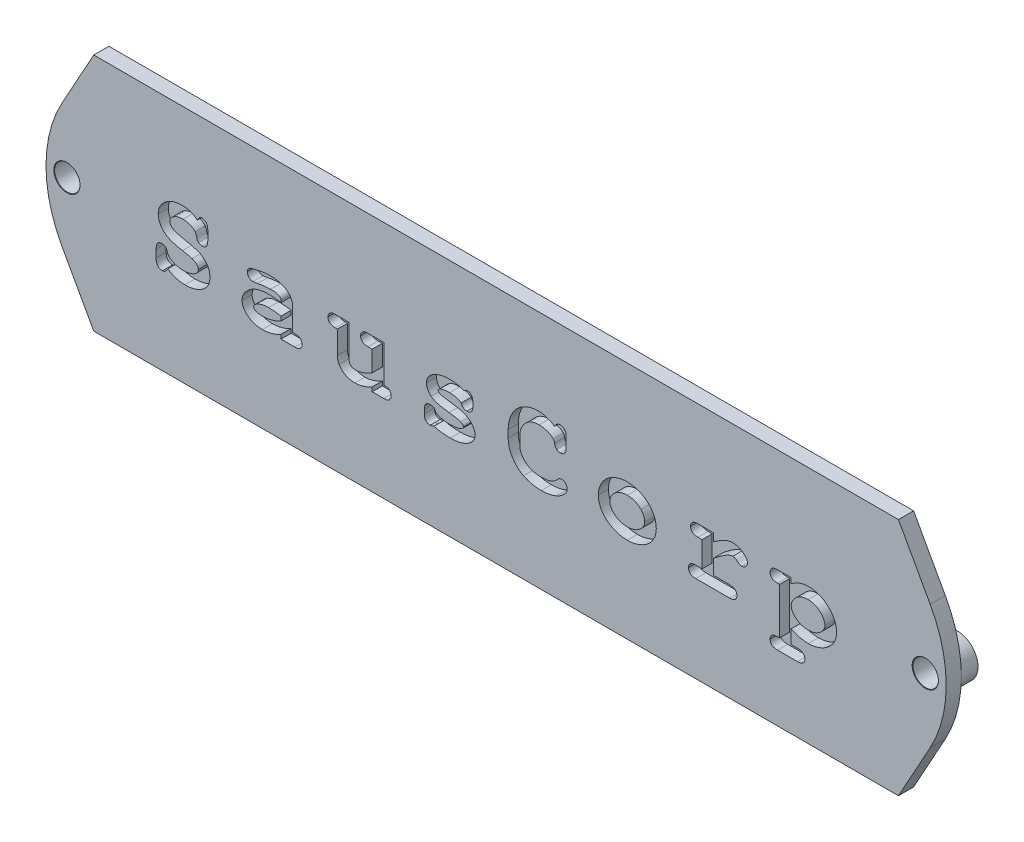
from build123d import *

# Parameters (mm, degrees)
BOSS_EXTRUDE1_DEPTH             = 1.905
SKETCH6_R                       = 2.629225159
BOSS_EXTRUDE4_DEPTH             = 2.095
F_3_0MM_DOWEL_HOLE1_D           = 3.2
F_3_0MM_DOWEL_HOLE1_CSINK_D     = 3.3
F_3_0MM_DOWEL_HOLE1_CSINK_ANGLE = 90
CUT_EXTRUDE1_DEPTH              = 1.27


with BuildPart() as part:
    # Sketch1 → Boss-Extrude1 (new body)
    with BuildSketch(Plane.XY):
        with BuildLine():
            Line((-50.6, 15.04), (50.6, 15.04))
            Line((50.6, 15.04), (54.590317598, 7.813493896))
            ThreePointArc((54.590317598, 7.813493896), (56.604225159, 0), (54.590317598, -7.813493896))
            Line((54.590317598, -7.813493896), (50.6, -15.04))
            Line((50.6, -15.04), (-50.6, -15.04))
            Line((-50.6, -15.04), (-54.590317598, -7.813493896))
            ThreePointArc((-54.590317598, -7.813493896), (-56.604225159, 0), (-54.590317598, 7.813493896))
            Line((-54.590317598, 7.813493896), (-50.6, 15.04))
        make_face()
    extrude(amount=BOSS_EXTRUDE1_DEPTH)

    # Sketch6 → Boss-Extrude4 (add)
    with BuildSketch(Plane(origin=(0, 0, 0), x_dir=(-1, 0, 0), z_dir=(0, 0, -1))):
        with Locations(Location((-53.975, 0, 0), (0, 0, 179.99945392))):
            Circle(SKETCH6_R)
        with Locations(Location((53.975, 0, 0), (0, 0, 359.99945398))):
            Circle(SKETCH6_R)
    extrude(amount=BOSS_EXTRUDE4_DEPTH)

    # Ø3.0mm Dowel Hole1 (through all)
    with Locations(Plane.XY.offset(1.905)):
        with Locations((53.975, 0), (-53.975, 0)):
            CounterSinkHole(F_3_0MM_DOWEL_HOLE1_D / 2, F_3_0MM_DOWEL_HOLE1_CSINK_D / 2, counter_sink_angle=F_3_0MM_DOWEL_HOLE1_CSINK_ANGLE)

    # Sketch4 → Cut-Extrude1 (cut)
    # profile 1 of 8: a face of its own
    with BuildSketch(Plane.XY.offset(1.905)):
        with BuildLine():
            add(Edge.make_bspline(
                [(-41.296390709, -3.597266465), (-41.328827746, -3.649516474), (-41.387859513, -3.744605624), (-41.478438377, -3.868682689), (-41.556521678, -3.963693737), (-41.648037971, -4.050326733), (-41.779409619, -4.114275606), (-41.890752025, -4.122966805), (-41.948826504, -4.1275)],
                knots=[0, 0, 0, 0, 1.249044756, 2.273121245, 3.119062961, 3.744647754, 4.823643111, 6, 6, 6, 6], degree=3))
            add(Edge.make_bspline(
                [(-41.948826504, -4.1275), (-42.007058112, -4.124766299), (-42.118913233, -4.119515224), (-42.278226788, -4.07796583), (-42.417595487, -4.005028344), (-42.541931203, -3.907419107), (-42.63989862, -3.770877994), (-42.706483253, -3.598719603), (-42.747486083, -3.392036812), (-42.75206958, -3.242614611), (-42.75453293, -3.162309268)],
                knots=[0, 0, 0, 0, 0.973747907, 1.870439342, 2.728107132, 3.590507668, 4.491652896, 5.50205726, 6.657507741, 8, 8, 8, 8], degree=3))
            Line((-42.75453293, -3.162309268), (-42.75453293, -2.182619964))
            add(Edge.make_bspline(
                [(-42.75453293, -2.182619964), (-42.752571494, -2.101649711), (-42.748908911, -1.950454205), (-42.712019179, -1.74260147), (-42.654723237, -1.568664494), (-42.565169322, -1.43350303), (-42.453638574, -1.333876212), (-42.327435466, -1.261826088), (-42.184157638, -1.219138506), (-42.083748268, -1.213921251), (-42.031675494, -1.211215558)],
                knots=[0, 0, 0, 0, 1.409758045, 2.632436904, 3.667729113, 4.578857077, 5.422311825, 6.252180417, 7.093572505, 8, 8, 8, 8], degree=3))
            add(Edge.make_bspline(
                [(-42.031675494, -1.211215558), (-41.991538863, -1.212907568), (-41.91403281, -1.216174932), (-41.801519291, -1.238589229), (-41.700197263, -1.280367327), (-41.608042245, -1.337954462), (-41.525495162, -1.41320088), (-41.457641435, -1.512059059), (-41.396317141, -1.629141078), (-41.352163974, -1.763059759), (-41.311706897, -1.894785056), (-41.262875683, -2.006855769), (-41.217902918, -2.097670697), (-41.180401531, -2.145096197), (-41.163832325, -2.166050166)],
                knots=[0, 0, 0, 0, 1.032771384, 1.994338619, 2.934499984, 3.836460035, 4.779302793, 5.784982907, 6.905255321, 8.169512914, 9.405370782, 10.448025371, 11.314292373, 12, 12, 12, 12], degree=3))
            add(Edge.make_bspline(
                [(-41.163832325, -2.166050166), (-41.125292422, -2.201574908), (-41.040651681, -2.279593798), (-40.882324382, -2.383853384), (-40.686372594, -2.48764798), (-40.459947604, -2.594354918), (-40.206558428, -2.68776067), (-39.935213227, -2.751684548), (-39.652624831, -2.796480929), (-39.460088437, -2.800080074), (-39.361866796, -2.801916163)],
                knots=[0, 0, 0, 0, 0.643712458, 1.413711371, 2.321640229, 3.369980337, 4.489889668, 5.634749748, 6.79337743, 8, 8, 8, 8], degree=3))
            add(Edge.make_bspline(
                [(-39.361866796, -2.801916163), (-39.285891699, -2.800709974), (-39.137156055, -2.798348631), (-38.919690017, -2.780312184), (-38.712967635, -2.746375936), (-38.516267439, -2.701370527), (-38.329242459, -2.64335085), (-38.153128783, -2.57319054), (-37.98686466, -2.49015725), (-37.884482556, -2.423209059), (-37.833302934, -2.389742438)],
                knots=[0, 0, 0, 0, 1.134315566, 2.220637595, 3.254383917, 4.25957164, 5.231163857, 6.174850205, 7.087628867, 8, 8, 8, 8], degree=3))
            add(Edge.make_bspline(
                [(-37.833302934, -2.389742438), (-37.774857996, -2.3482627), (-37.66442298, -2.269884387), (-37.544437952, -2.11546032), (-37.463732376, -1.949025481), (-37.456045747, -1.830022728), (-37.452197581, -1.770446239)],
                knots=[0, 0, 0, 0, 1.127408559, 2.13030224, 3.063970995, 4, 4, 4, 4], degree=3))
            add(Edge.make_bspline(
                [(-37.452197581, -1.770446239), (-37.453721892, -1.729393869), (-37.456752804, -1.647766122), (-37.496124711, -1.529398632), (-37.551512376, -1.413428301), (-37.634453511, -1.303356614), (-37.741000118, -1.197752477), (-37.878665602, -1.106035448), (-38.042098431, -1.019581673), (-38.164051838, -0.974314432), (-38.22890686, -0.95024124)],
                knots=[0, 0, 0, 0, 0.811818184, 1.614203749, 2.454243724, 3.356431144, 4.335651608, 5.419560622, 6.627718108, 8, 8, 8, 8], degree=3))
            add(Edge.make_bspline(
                [(-38.22890686, -0.95024124), (-38.255132641, -0.941934857), (-38.313633012, -0.923406277), (-38.411643215, -0.89297677), (-38.532094584, -0.866378787), (-38.672202213, -0.831385737), (-38.834535219, -0.800383403), (-39.016161047, -0.761268695), (-39.219753448, -0.725741385), (-39.361898618, -0.699095796), (-39.436430887, -0.685124472)],
                knots=[0, 0, 0, 0, 0.533700084, 1.190494666, 1.989587104, 2.925169266, 3.991560706, 5.194531176, 6.52898302, 8, 8, 8, 8], degree=3))
            add(Edge.make_bspline(
                [(-39.436430887, -0.685124472), (-39.528329006, -0.668245499), (-39.706927733, -0.635442182), (-39.965847501, -0.581370597), (-40.20856094, -0.52606466), (-40.434677524, -0.466600372), (-40.643737869, -0.400799732), (-40.838381281, -0.338820108), (-41.015320108, -0.270063532), (-41.226034687, -0.174322488), (-41.466896812, -0.041113887), (-41.724324593, 0.151557749), (-41.950834556, 0.373131407), (-42.142525979, 0.622756853), (-42.296472449, 0.893903627), (-42.406385426, 1.179445054), (-42.476375531, 1.475963514), (-42.485041335, 1.67775896), (-42.489416163, 1.779632975)],
                knots=[0, 0, 0, 0, 1.039724996, 2.020645932, 2.94317358, 3.809745427, 4.621449807, 5.381904657, 6.082442966, 6.732275347, 7.956853422, 9.136952481, 10.29959077, 11.472087457, 12.628030181, 13.756610505, 14.867451672, 16, 16, 16, 16], degree=3))
            add(Edge.make_bspline(
                [(-42.489416163, 1.779632975), (-42.487475173, 1.859923808), (-42.483633021, 2.018857997), (-42.439228635, 2.252743368), (-42.373292471, 2.479135469), (-42.282256605, 2.699216659), (-42.159497811, 2.908561043), (-42.014568793, 3.112859321), (-41.841065884, 3.307961191), (-41.643186406, 3.492623827), (-41.42551608, 3.664485841), (-41.188311964, 3.813381639), (-40.935647805, 3.941446133), (-40.666547117, 4.043635615), (-40.381954844, 4.125517663), (-40.081848422, 4.183069089), (-39.765103213, 4.215842853), (-39.549042816, 4.221026249), (-39.438502112, 4.223678175)],
                knots=[0, 0, 0, 0, 0.885991119, 1.753802725, 2.620305997, 3.488687286, 4.377072049, 5.29569036, 6.252193784, 7.255919361, 8.282824222, 9.311285966, 10.344882855, 11.407292653, 12.486464723, 13.612907354, 14.778716939, 16, 16, 16, 16], degree=3))
            add(Edge.make_bspline(
                [(-39.438502112, 4.223678175), (-39.349328865, 4.221842494), (-39.173878604, 4.218230751), (-38.91580017, 4.185063416), (-38.666884319, 4.137734065), (-38.428902564, 4.063349161), (-38.20049996, 3.970563186), (-37.982688568, 3.856256364), (-37.774954495, 3.721411264), (-37.648586484, 3.614758358), (-37.584755964, 3.560886257)],
                knots=[0, 0, 0, 0, 1.06217376, 2.089849486, 3.096729674, 4.077901227, 5.055755432, 6.03101011, 7.005431474, 8, 8, 8, 8], degree=3))
            add(Edge.make_bspline(
                [(-37.584755964, 3.560886257), (-37.539074691, 3.640195418), (-37.456398066, 3.78373375), (-37.309113622, 3.951827425), (-37.161128686, 4.067745063), (-37.052517149, 4.083773949), (-37.002741811, 4.091119792)],
                knots=[0, 0, 0, 0, 1.335042247, 2.416237083, 3.274180847, 4, 4, 4, 4], degree=3))
            add(Edge.make_bspline(
                [(-37.002741811, 4.091119792), (-36.949980942, 4.088412372), (-36.848220897, 4.083190563), (-36.702952915, 4.040519329), (-36.573722594, 3.968125117), (-36.459709917, 3.867102277), (-36.365134986, 3.732243876), (-36.303497245, 3.558879916), (-36.264165516, 3.35140348), (-36.260917783, 3.200712028), (-36.259172127, 3.119715386)],
                knots=[0, 0, 0, 0, 0.910188534, 1.755483361, 2.588319905, 3.449945611, 4.366363053, 5.400671473, 6.60286114, 8, 8, 8, 8], degree=3))
            Line((-36.259172127, 3.119715386), (-36.259172127, 2.019895046))
            add(Edge.make_bspline(
                [(-36.259172127, 2.019895046), (-36.261161473, 1.938258361), (-36.26486159, 1.786416902), (-36.301256163, 1.576689089), (-36.361535352, 1.402369705), (-36.449773582, 1.265402432), (-36.559670847, 1.16566687), (-36.681874637, 1.09286752), (-36.82053324, 1.05040887), (-36.917533693, 1.045042812), (-36.96753099, 1.042276966)],
                knots=[0, 0, 0, 0, 1.43094185, 2.661503211, 3.7189797, 4.646082909, 5.486029776, 6.30026239, 7.123898056, 8, 8, 8, 8], degree=3))
            add(Edge.make_bspline(
                [(-36.96753099, 1.042276966), (-37.010537459, 1.044240481), (-37.094125515, 1.048056799), (-37.214290805, 1.078628085), (-37.327001407, 1.125549211), (-37.392272708, 1.173417993), (-37.425271659, 1.197618822)],
                knots=[0, 0, 0, 0, 1.046511982, 2.034017323, 3.006065985, 4, 4, 4, 4], degree=3))
            add(Edge.make_bspline(
                [(-37.425271659, 1.197618822), (-37.450744987, 1.220686806), (-37.505786551, 1.270531018), (-37.565436451, 1.376483933), (-37.617732377, 1.507419053), (-37.655587218, 1.659960282), (-37.692059415, 1.813800828), (-37.73800041, 1.950446207), (-37.787677498, 2.063523872), (-37.830386762, 2.126013813), (-37.849872732, 2.154524654)],
                knots=[0, 0, 0, 0, 0.773101546, 1.67048129, 2.714621154, 3.961209941, 5.218903981, 6.290714081, 7.220143603, 8, 8, 8, 8], degree=3))
            add(Edge.make_bspline(
                [(-37.849872732, 2.154524654), (-37.885871053, 2.197236048), (-37.960526298, 2.285813225), (-38.102229639, 2.39761921), (-38.265402922, 2.502691512), (-38.452383239, 2.594153912), (-38.659484121, 2.671169367), (-38.883804737, 2.726600943), (-39.124015645, 2.760534555), (-39.289257559, 2.76383664), (-39.374294145, 2.765535954)],
                knots=[0, 0, 0, 0, 0.788748807, 1.635749515, 2.541050582, 3.533008496, 4.574868368, 5.662636679, 6.79714904, 8, 8, 8, 8], degree=3))
            add(Edge.make_bspline(
                [(-39.374294145, 2.765535954), (-39.495399512, 2.761944676), (-39.726260737, 2.755098681), (-40.053672151, 2.693342097), (-40.341511861, 2.588438033), (-40.583539511, 2.443180679), (-40.776567142, 2.277762487), (-40.920842933, 2.105875066), (-41.0150651, 1.926406869), (-41.02601989, 1.80061231), (-41.031273942, 1.740279705)],
                knots=[0, 0, 0, 0, 1.364096086, 2.600354546, 3.73798518, 4.799013634, 5.764657691, 6.588719767, 7.323132778, 8, 8, 8, 8], degree=3))
            add(Edge.make_bspline(
                [(-41.031273942, 1.740279705), (-41.029663481, 1.699241144), (-41.026409145, 1.616312522), (-40.987078553, 1.495645154), (-40.934041053, 1.374765614), (-40.854206948, 1.260271123), (-40.754809991, 1.150884485), (-40.630831493, 1.05685102), (-40.488733397, 0.972282571), (-40.383653748, 0.929728386), (-40.329128753, 0.907647357)],
                knots=[0, 0, 0, 0, 0.846576937, 1.710719334, 2.606455908, 3.574050018, 4.585845271, 5.65548649, 6.783450568, 8, 8, 8, 8], degree=3))
            add(Edge.make_bspline(
                [(-40.329128753, 0.907647357), (-40.305767124, 0.899008508), (-40.250809112, 0.878685697), (-40.153205545, 0.853871035), (-40.030534639, 0.82202829), (-39.881854368, 0.787710519), (-39.70753531, 0.747400374), (-39.506856079, 0.70740031), (-39.280777158, 0.660608851), (-38.952594054, 0.600546295), (-38.550964152, 0.522301122), (-38.107076445, 0.411794067), (-37.720606443, 0.29949949), (-37.385616703, 0.179809104), (-37.090259801, 0.038589375), (-36.828879486, -0.138921074), (-36.591233216, -0.350714229), (-36.383719976, -0.596710223), (-36.206937259, -0.869835486), (-36.084469217, -1.174993283), (-36.007152847, -1.503548103), (-35.998494118, -1.732026841), (-35.99405536, -1.84915278)],
                knots=[0, 0, 0, 0, 0.26449417, 0.622220044, 1.06879785, 1.611494514, 2.243263886, 2.969799311, 3.785520021, 4.696246612, 6.514713391, 8.131992221, 9.554843785, 10.789518018, 11.90826174, 13.023223103, 14.135018638, 15.280006539, 16.433959636, 17.575535029, 18.757137159, 20, 20, 20, 20], degree=3))
            add(Edge.make_bspline(
                [(-35.99405536, -1.84915278), (-35.995516481, -1.931467193), (-35.998367302, -2.092072277), (-36.036106667, -2.326319057), (-36.090849654, -2.54792114), (-36.168063926, -2.758332936), (-36.269486921, -2.955365852), (-36.395655793, -3.138211574), (-36.540689407, -3.310621175), (-36.653469765, -3.411464723), (-36.710699122, -3.462636857)],
                knots=[0, 0, 0, 0, 1.08074052, 2.108651617, 3.109986721, 4.077490323, 5.047416246, 6.01385551, 6.992149213, 8, 8, 8, 8], degree=3))
            add(Edge.make_bspline(
                [(-36.710699122, -3.462636857), (-36.791595506, -3.526566805), (-36.953301013, -3.654357741), (-37.218966885, -3.814049238), (-37.497215383, -3.955778314), (-37.794578629, -4.065926375), (-38.107550697, -4.154064172), (-38.436881872, -4.21490688), (-38.782390752, -4.253365783), (-39.01793852, -4.25779664), (-39.138174524, -4.260058384)],
                knots=[0, 0, 0, 0, 0.947636307, 1.894250398, 2.845795026, 3.816645282, 4.805996643, 5.833687451, 6.894199829, 8, 8, 8, 8], degree=3))
            add(Edge.make_bspline(
                [(-39.138174524, -4.260058384), (-39.232851769, -4.258134211), (-39.420649425, -4.254317506), (-39.700968156, -4.221513211), (-39.977355188, -4.170643727), (-40.250042363, -4.097426588), (-40.518013051, -4.004074085), (-40.78193667, -3.888914088), (-41.043576456, -3.755233157), (-41.211506365, -3.650305006), (-41.296390709, -3.597266465)],
                knots=[0, 0, 0, 0, 0.992019957, 1.967727543, 2.95411, 3.935302966, 4.923938984, 5.925414969, 6.951349458, 8, 8, 8, 8], degree=3))
        make_face()
    # profile 2 of 8: a face of its own
    with BuildSketch(Plane.XY.offset(1.905)):
        with BuildLine():
            Line((-27.046364457, -4.1275), (-27.046364457, -3.597266465))
            add(Edge.make_bspline(
                [(-27.046364457, -3.597266465), (-27.13669751, -3.650532077), (-27.317793701, -3.757316905), (-27.605739418, -3.891483778), (-27.90680214, -4.006011505), (-28.217659478, -4.096635903), (-28.527591918, -4.168735643), (-28.827032502, -4.220370659), (-29.112693994, -4.253698734), (-29.298392023, -4.257974131), (-29.388919645, -4.260058384)],
                knots=[0, 0, 0, 0, 1.021473461, 2.047810267, 3.091228891, 4.157797131, 5.200695, 6.190683146, 7.117959661, 8, 8, 8, 8], degree=3))
            add(Edge.make_bspline(
                [(-29.388919645, -4.260058384), (-29.481531382, -4.258946515), (-29.663096014, -4.256766703), (-29.928654053, -4.225563356), (-30.181212689, -4.182075736), (-30.420008905, -4.116466284), (-30.64592102, -4.034804015), (-30.857839663, -3.93171745), (-31.058793906, -3.814721535), (-31.24055106, -3.67578586), (-31.405437083, -3.527533813), (-31.550493325, -3.374710513), (-31.675408576, -3.218654713), (-31.773942585, -3.056218876), (-31.85530845, -2.891413179), (-31.910449056, -2.721164718), (-31.945658361, -2.547230795), (-31.949231547, -2.429953784), (-31.951024656, -2.371101415)],
                knots=[0, 0, 0, 0, 1.263658026, 2.477392306, 3.645922748, 4.759518061, 5.8539592, 6.920607257, 7.972999156, 9.023066726, 10.037586764, 10.997752794, 11.897240388, 12.760538052, 13.586867616, 14.400628698, 15.197397777, 16, 16, 16, 16], degree=3))
            add(Edge.make_bspline(
                [(-31.951024656, -2.371101415), (-31.948023083, -2.299126322), (-31.942028375, -2.155378466), (-31.899916523, -1.941589989), (-31.825642145, -1.733609711), (-31.725317454, -1.52948867), (-31.597919213, -1.329148447), (-31.440332265, -1.13401325), (-31.256071111, -0.941251965), (-31.043219659, -0.756323612), (-30.807266138, -0.582370923), (-30.546118831, -0.430690475), (-30.263382474, -0.301370037), (-29.957143145, -0.199691119), (-29.631525361, -0.115714341), (-29.28361742, -0.058432749), (-28.914542476, -0.026012522), (-28.661294101, -0.020841644), (-28.5314326, -0.018190104)],
                knots=[0, 0, 0, 0, 0.753685691, 1.505252672, 2.271322891, 3.060355256, 3.882772473, 4.752282446, 5.683040191, 6.672050212, 7.701772438, 8.748440264, 9.82916972, 10.95187303, 12.123344688, 13.347712692, 14.639951741, 16, 16, 16, 16], degree=3))
            add(Edge.make_bspline(
                [(-28.5314326, -0.018190104), (-28.420221815, -0.019721174), (-28.189211295, -0.022901561), (-27.830056312, -0.052703465), (-27.445664292, -0.094617224), (-27.182211607, -0.137118146), (-27.046364457, -0.159033387)],
                knots=[0, 0, 0, 0, 0.893491487, 1.855988449, 2.894458568, 4, 4, 4, 4], degree=3))
            Line((-27.046364457, -0.159033387), (-27.046364457, 0.097798482))
            add(Edge.make_bspline(
                [(-27.046364457, 0.097798482), (-27.049197229, 0.137142772), (-27.054829379, 0.215367553), (-27.112686563, 0.323478107), (-27.200723528, 0.41878341), (-27.300743034, 0.484389878), (-27.399510094, 0.529480026), (-27.491868037, 0.560395961), (-27.599356541, 0.586475517), (-27.721624528, 0.609444561), (-27.859313008, 0.625874554), (-28.012879483, 0.634502792), (-28.181969582, 0.644351964), (-28.300127802, 0.644516319), (-28.361592171, 0.644601815)],
                knots=[0, 0, 0, 0, 0.898130765, 1.785674157, 2.752208503, 3.861886227, 4.508368837, 5.246429344, 6.097434903, 7.050311012, 8.105853498, 9.283419901, 10.586870369, 12, 12, 12, 12], degree=3))
            add(Edge.make_bspline(
                [(-28.361592171, 0.644601815), (-28.474192956, 0.6416797), (-28.715731212, 0.635411515), (-29.101606316, 0.598349305), (-29.533793528, 0.534952284), (-29.836478212, 0.479233064), (-29.995788495, 0.449906688)],
                knots=[0, 0, 0, 0, 0.820023028, 1.75901911, 2.820517451, 4, 4, 4, 4], degree=3))
            add(Edge.make_bspline(
                [(-29.995788495, 0.449906688), (-30.054368241, 0.438846764), (-30.164972766, 0.417964502), (-30.322201455, 0.399170194), (-30.459373085, 0.38179511), (-30.544618054, 0.380215231), (-30.584016323, 0.379485047)],
                knots=[0, 0, 0, 0, 1.205604858, 2.27630472, 3.203347571, 4, 4, 4, 4], degree=3))
            add(Edge.make_bspline(
                [(-30.584016323, 0.379485047), (-30.631231899, 0.381734465), (-30.723765687, 0.386142908), (-30.856872225, 0.42516233), (-30.978947461, 0.487928476), (-31.086664092, 0.575397877), (-31.176131334, 0.682803733), (-31.240685024, 0.807209812), (-31.282451552, 0.945053796), (-31.286264544, 1.041963474), (-31.288232737, 1.09198636)],
                knots=[0, 0, 0, 0, 1.011281251, 1.98192406, 2.949282879, 3.939511738, 4.939115363, 5.92645887, 6.929678502, 8, 8, 8, 8], degree=3))
            add(Edge.make_bspline(
                [(-31.288232737, 1.09198636), (-31.284771951, 1.147004275), (-31.278157716, 1.252154207), (-31.224382896, 1.398268243), (-31.138447138, 1.518603089), (-31.037887454, 1.598053803), (-30.931126299, 1.650684032), (-30.816295684, 1.69603404), (-30.666889941, 1.742056107), (-30.555789802, 1.773028988), (-30.494953659, 1.789989099)],
                knots=[0, 0, 0, 0, 1.133166917, 2.165702264, 3.166370469, 4.150150705, 4.77479147, 5.619016697, 6.696222671, 8, 8, 8, 8], degree=3))
            add(Edge.make_bspline(
                [(-30.494953659, 1.789989099), (-30.315903626, 1.834822593), (-29.957108199, 1.924663697), (-29.502883978, 2.006219686), (-29.143642389, 2.055704191), (-28.886106136, 2.083826368), (-28.642050092, 2.097752612), (-28.483807073, 2.10111527), (-28.407159115, 2.102744036)],
                knots=[0, 0, 0, 0, 1.569560792, 3.145217159, 3.921693234, 4.653827315, 5.347956156, 6, 6, 6, 6], degree=3))
            add(Edge.make_bspline(
                [(-28.407159115, 2.102744036), (-28.298728347, 2.101163147), (-28.087780416, 2.098087587), (-27.780383359, 2.074021816), (-27.491679141, 2.029068664), (-27.220685282, 1.974006974), (-26.969742307, 1.895620961), (-26.73715801, 1.803227943), (-26.522583598, 1.693272694), (-26.327688401, 1.566861654), (-26.152977021, 1.426999441), (-26.002769888, 1.271467224), (-25.872704059, 1.106138572), (-25.768562583, 0.925815403), (-25.687773787, 0.734350075), (-25.628418385, 0.530935668), (-25.59615607, 0.314235672), (-25.590906977, 0.165557599), (-25.588222236, 0.089513583)],
                knots=[0, 0, 0, 0, 1.334808255, 2.596818626, 3.791614657, 4.930159276, 5.997444263, 7.023316308, 8.007831036, 8.960235168, 9.878778704, 10.756298507, 11.616525585, 12.462014984, 13.311297843, 14.169380918, 15.063697662, 16, 16, 16, 16], degree=3))
            Line((-25.588222236, 0.089513583), (-25.588222236, -2.669357779))
            Line((-25.588222236, -2.669357779), (-25.323105469, -2.669357779))
            add(Edge.make_bspline(
                [(-25.323105469, -2.669357779), (-25.247645496, -2.671219632), (-25.105894264, -2.674717114), (-24.90982104, -2.713545747), (-24.745156296, -2.776594761), (-24.614775348, -2.868274146), (-24.516600699, -2.979438365), (-24.445663202, -3.105718992), (-24.403289358, -3.247332432), (-24.397948719, -3.347047495), (-24.395196783, -3.398428889)],
                knots=[0, 0, 0, 0, 1.353154287, 2.541894464, 3.570795155, 4.495901044, 5.373971119, 6.211928534, 7.078638652, 8, 8, 8, 8], degree=3))
            add(Edge.make_bspline(
                [(-24.395196783, -3.398428889), (-24.397914733, -3.449829608), (-24.403189416, -3.549582173), (-24.446207192, -3.69151349), (-24.515885665, -3.819232522), (-24.614917633, -3.93046562), (-24.744685287, -4.022790186), (-24.910380387, -4.082601324), (-25.10579911, -4.122375039), (-25.247612439, -4.12571957), (-25.323105469, -4.1275)],
                knots=[0, 0, 0, 0, 0.920639213, 1.786670031, 2.634802021, 3.512183892, 4.436564712, 5.460097794, 6.647906274, 8, 8, 8, 8], degree=3))
            Line((-25.323105469, -4.1275), (-27.046364457, -4.1275))
        make_face()
        with BuildLine():
            add(Edge.make_bspline(
                [(-27.046364457, -1.621318057), (-27.18496753, -1.598708948), (-27.456630916, -1.554394871), (-27.857538133, -1.509837046), (-28.242409269, -1.480898305), (-28.493410817, -1.47783349), (-28.616352815, -1.476332325)],
                knots=[0, 0, 0, 0, 1.067423571, 2.092160695, 3.065529373, 4, 4, 4, 4], degree=3))
            add(Edge.make_bspline(
                [(-28.616352815, -1.476332325), (-28.756126768, -1.480407697), (-29.027100386, -1.48830844), (-29.417921516, -1.557832557), (-29.779395879, -1.672140078), (-29.997886977, -1.78655388), (-30.105563407, -1.842939105)],
                knots=[0, 0, 0, 0, 1.080601596, 2.094914797, 3.061138992, 4, 4, 4, 4], degree=3))
            add(Edge.make_bspline(
                [(-30.105563407, -1.842939105), (-30.163703968, -1.880369341), (-30.269188597, -1.948279152), (-30.393393874, -2.067669556), (-30.475566193, -2.190466732), (-30.487374277, -2.278333356), (-30.492882434, -2.319320797)],
                knots=[0, 0, 0, 0, 1.296291176, 2.351865741, 3.231189249, 4, 4, 4, 4], degree=3))
            add(Edge.make_bspline(
                [(-30.492882434, -2.319320797), (-30.490346742, -2.347309261), (-30.485258364, -2.403473748), (-30.44792521, -2.482210513), (-30.387059607, -2.550881261), (-30.334399124, -2.584990022), (-30.306472207, -2.603078587)],
                knots=[0, 0, 0, 0, 0.942299213, 1.890913021, 2.881508614, 4, 4, 4, 4], degree=3))
            add(Edge.make_bspline(
                [(-30.306472207, -2.603078587), (-30.244502982, -2.634252674), (-30.113824223, -2.699991612), (-29.888772391, -2.758100862), (-29.633965024, -2.796077379), (-29.453300384, -2.799897767), (-29.357851274, -2.801916163)],
                knots=[0, 0, 0, 0, 0.847921706, 1.788070683, 2.831389006, 4, 4, 4, 4], degree=3))
            add(Edge.make_bspline(
                [(-29.357851274, -2.801916163), (-29.26937492, -2.799990224), (-29.087002176, -2.796020364), (-28.805623383, -2.759618032), (-28.507332237, -2.706505004), (-28.197780339, -2.629997109), (-27.887253906, -2.537409664), (-27.589515354, -2.424972443), (-27.307768809, -2.300403755), (-27.13260159, -2.200657828), (-27.046364457, -2.151551592)],
                knots=[0, 0, 0, 0, 0.874978406, 1.803557734, 2.803062558, 3.871624944, 4.956372845, 6.006858709, 7.018750249, 8, 8, 8, 8], degree=3))
            Line((-27.046364457, -2.151551592), (-27.046364457, -1.621318057))
        make_face(mode=Mode.SUBTRACT)
    # profile 3 of 8: a face of its own
    with BuildSketch(Plane.XY.offset(1.905)):
        with BuildLine():
            Line((-14.121922043, 1.970185652), (-14.121922043, -2.669357779))
            add(Edge.make_bspline(
                [(-14.121922043, -2.669357779), (-14.04646207, -2.671219632), (-13.904710838, -2.674717114), (-13.708637614, -2.713545747), (-13.54397287, -2.776594761), (-13.413591922, -2.868274146), (-13.315417273, -2.979438365), (-13.244479777, -3.105718992), (-13.202105932, -3.247332432), (-13.196765293, -3.347047495), (-13.194013357, -3.398428889)],
                knots=[0, 0, 0, 0, 1.353154287, 2.541894464, 3.570795155, 4.495901044, 5.373971119, 6.211928534, 7.078638652, 8, 8, 8, 8], degree=3))
            add(Edge.make_bspline(
                [(-13.194013357, -3.398428889), (-13.196731307, -3.449829608), (-13.20200599, -3.549582173), (-13.245023766, -3.69151349), (-13.31470224, -3.819232522), (-13.413734207, -3.93046562), (-13.543501861, -4.022790186), (-13.709196962, -4.082601324), (-13.904615684, -4.122375039), (-14.046429013, -4.12571957), (-14.121922043, -4.1275)],
                knots=[0, 0, 0, 0, 0.920639213, 1.786670031, 2.634802021, 3.512183892, 4.436564712, 5.460097794, 6.647906274, 8, 8, 8, 8], degree=3))
            Line((-14.121922043, -4.1275), (-15.580064264, -4.1275))
            Line((-15.580064264, -4.1275), (-15.580064264, -3.597266465))
            add(Edge.make_bspline(
                [(-15.580064264, -3.597266465), (-15.678322838, -3.649961831), (-15.869955247, -3.752732913), (-16.159294434, -3.888349526), (-16.442314594, -4.001882824), (-16.718653, -4.096139145), (-16.987804822, -4.168854429), (-17.249981194, -4.221107015), (-17.505471135, -4.253814192), (-17.673981059, -4.257998749), (-17.756921472, -4.260058384)],
                knots=[0, 0, 0, 0, 1.163720423, 2.269588689, 3.333519286, 4.345406718, 5.315657125, 6.24142042, 7.134428922, 8, 8, 8, 8], degree=3))
            add(Edge.make_bspline(
                [(-17.756921472, -4.260058384), (-17.867591472, -4.257179468), (-18.083314507, -4.251567753), (-18.395278003, -4.199297798), (-18.684125989, -4.111988775), (-18.94891305, -3.991496388), (-19.188438322, -3.839745289), (-19.40066638, -3.659281633), (-19.591114357, -3.456118838), (-19.69226609, -3.300682903), (-19.743226003, -3.222374786)],
                knots=[0, 0, 0, 0, 1.130242862, 2.203121184, 3.220832889, 4.205861717, 5.166872755, 6.108154423, 7.046894372, 8, 8, 8, 8], degree=3))
            add(Edge.make_bspline(
                [(-19.743226003, -3.222374786), (-19.776635637, -3.161225165), (-19.844806832, -3.036451489), (-19.90511867, -2.824033115), (-19.949533179, -2.593910999), (-19.952799431, -2.432109973), (-19.954490927, -2.348317943)],
                knots=[0, 0, 0, 0, 0.916308781, 1.86969621, 2.896777833, 4, 4, 4, 4], degree=3))
            Line((-19.954490927, -2.348317943), (-19.954490927, 0.512043431))
            Line((-19.954490927, 0.512043431), (-20.219607695, 0.512043431))
            add(Edge.make_bspline(
                [(-20.219607695, 0.512043431), (-20.295085067, 0.513843712), (-20.436868984, 0.517225533), (-20.63247899, 0.556756732), (-20.798114922, 0.617516531), (-20.92980001, 0.707661649), (-21.026611188, 0.821128328), (-21.096623495, 0.9479181), (-21.139491924, 1.089991543), (-21.144787609, 1.189724122), (-21.147516381, 1.241114541)],
                knots=[0, 0, 0, 0, 1.351758791, 2.539273031, 3.562552567, 4.496852515, 5.365850662, 6.213772556, 7.079588844, 8, 8, 8, 8], degree=3))
            add(Edge.make_bspline(
                [(-21.147516381, 1.241114541), (-21.144753598, 1.292485625), (-21.139391909, 1.39218068), (-21.097167138, 1.53393582), (-21.025906186, 1.659295866), (-20.929943258, 1.772685518), (-20.797638532, 1.862175148), (-20.633038282, 1.926182482), (-20.436773922, 1.964769449), (-20.295052042, 1.968304043), (-20.219607695, 1.970185652)],
                knots=[0, 0, 0, 0, 0.921132933, 1.787628184, 2.62537786, 3.495057466, 4.430090083, 5.458735699, 6.647181174, 8, 8, 8, 8], degree=3))
            Line((-20.219607695, 1.970185652), (-18.496348706, 1.970185652))
            Line((-18.496348706, 1.970185652), (-18.496348706, -1.985853613))
            add(Edge.make_bspline(
                [(-18.496348706, -1.985853613), (-18.494495557, -2.051661013), (-18.491022694, -2.174986239), (-18.451805125, -2.346993544), (-18.38505238, -2.491411689), (-18.291522579, -2.610834588), (-18.166804411, -2.699549806), (-18.015116255, -2.758325487), (-17.838850157, -2.796181032), (-17.712266129, -2.799927525), (-17.645075336, -2.801916163)],
                knots=[0, 0, 0, 0, 1.161957381, 2.177546247, 3.09492669, 3.95470552, 4.828835754, 5.765027147, 6.813676551, 8, 8, 8, 8], degree=3))
            add(Edge.make_bspline(
                [(-17.645075336, -2.801916163), (-17.574565284, -2.79968131), (-17.430916827, -2.795128297), (-17.211898454, -2.764846536), (-16.985514713, -2.714703551), (-16.74754361, -2.642289864), (-16.490764206, -2.545818108), (-16.211430913, -2.414697034), (-15.902887953, -2.255758748), (-15.69137263, -2.133198842), (-15.580064264, -2.068702603)],
                knots=[0, 0, 0, 0, 0.763084563, 1.554614081, 2.388598748, 3.270355788, 4.244617858, 5.354668166, 6.607913799, 8, 8, 8, 8], degree=3))
            Line((-15.580064264, -2.068702603), (-15.580064264, 0.512043431))
            Line((-15.580064264, 0.512043431), (-16.110297799, 0.512043431))
            add(Edge.make_bspline(
                [(-16.110297799, 0.512043431), (-16.185775171, 0.513843712), (-16.327559088, 0.517225533), (-16.523169094, 0.556756732), (-16.688805026, 0.617516531), (-16.820490114, 0.707661649), (-16.917301292, 0.821128328), (-16.987313599, 0.9479181), (-17.030182028, 1.089991543), (-17.035477713, 1.189724122), (-17.038206485, 1.241114541)],
                knots=[0, 0, 0, 0, 1.351758791, 2.539273031, 3.562552567, 4.496852515, 5.365850662, 6.213772556, 7.079588844, 8, 8, 8, 8], degree=3))
            add(Edge.make_bspline(
                [(-17.038206485, 1.241114541), (-17.035443702, 1.292485625), (-17.030082013, 1.39218068), (-16.987857242, 1.53393582), (-16.91659629, 1.659295866), (-16.820633362, 1.772685518), (-16.688328637, 1.862175148), (-16.523728386, 1.926182482), (-16.327464026, 1.964769449), (-16.185742147, 1.968304043), (-16.110297799, 1.970185652)],
                knots=[0, 0, 0, 0, 0.921132933, 1.787628184, 2.62537786, 3.495057466, 4.430090083, 5.458735699, 6.647181174, 8, 8, 8, 8], degree=3))
            Line((-16.110297799, 1.970185652), (-14.121922043, 1.970185652))
        make_face()
    # profile 4 of 8: a face of its own
    with BuildSketch(Plane.XY.offset(1.905)):
        with BuildLine():
            add(Edge.make_bspline(
                [(-4.378880838, 0.251069113), (-4.490550764, 0.311846513), (-4.712694297, 0.432750207), (-5.074125135, 0.552412208), (-5.44972774, 0.631131892), (-5.706814592, 0.640073234), (-5.837023059, 0.644601815)],
                knots=[0, 0, 0, 0, 0.996794651, 1.982910641, 2.978391496, 4, 4, 4, 4], degree=3))
            add(Edge.make_bspline(
                [(-5.837023059, 0.644601815), (-5.962188881, 0.642432536), (-6.199640732, 0.638317201), (-6.534546673, 0.591521729), (-6.831935534, 0.521869208), (-7.006844712, 0.44224607), (-7.090114031, 0.404339744)],
                knots=[0, 0, 0, 0, 1.166009211, 2.21203394, 3.148799864, 4, 4, 4, 4], degree=3))
            add(Edge.make_bspline(
                [(-7.090114031, 0.404339744), (-7.12050581, 0.387394801), (-7.175761464, 0.356587), (-7.242352426, 0.3003305), (-7.286838123, 0.239622153), (-7.292539012, 0.194993288), (-7.295165281, 0.174433797)],
                knots=[0, 0, 0, 0, 1.291400539, 2.34791057, 3.238920422, 4, 4, 4, 4], degree=3))
            add(Edge.make_bspline(
                [(-7.295165281, 0.174433797), (-7.291615905, 0.150125202), (-7.283717074, 0.096028514), (-7.220911213, 0.025682246), (-7.131707174, -0.043123428), (-7.057181574, -0.081610562), (-7.01554994, -0.103110319)],
                knots=[0, 0, 0, 0, 0.702978967, 1.564419199, 2.639431174, 4, 4, 4, 4], degree=3))
            add(Edge.make_bspline(
                [(-7.01554994, -0.103110319), (-6.969618066, -0.120749038), (-6.858719095, -0.163336367), (-6.652550669, -0.205587689), (-6.38338942, -0.253691279), (-6.181008442, -0.280755478), (-6.069000231, -0.29573422)],
                knots=[0, 0, 0, 0, 0.608963426, 1.470295274, 2.599929181, 4, 4, 4, 4], degree=3))
            add(Edge.make_bspline(
                [(-6.069000231, -0.29573422), (-5.96057407, -0.309994034), (-5.751857521, -0.337443674), (-5.451486315, -0.380841216), (-5.176027831, -0.424497642), (-4.924976125, -0.466663728), (-4.699738399, -0.513701938), (-4.4986874, -0.555132335), (-4.323433487, -0.601192903), (-4.215845371, -0.634392051), (-4.16554469, -0.649913652)],
                knots=[0, 0, 0, 0, 1.35399175, 2.606386533, 3.757358084, 4.807130497, 5.757653755, 6.606020825, 7.348272797, 8, 8, 8, 8], degree=3))
            add(Edge.make_bspline(
                [(-4.16554469, -0.649913652), (-4.050419837, -0.691933913), (-3.828101233, -0.773079606), (-3.524417083, -0.937568073), (-3.263932298, -1.134581018), (-3.046811994, -1.357423863), (-2.87472327, -1.59765802), (-2.746300151, -1.846363958), (-2.670970632, -2.105105337), (-2.660706956, -2.280205934), (-2.65562185, -2.366958966)],
                knots=[0, 0, 0, 0, 1.204294895, 2.325624364, 3.382290655, 4.405183634, 5.37379903, 6.278814968, 7.147244367, 8, 8, 8, 8], degree=3))
            add(Edge.make_bspline(
                [(-2.65562185, -2.366958966), (-2.657551155, -2.425778742), (-2.661347007, -2.541504942), (-2.693206006, -2.710829707), (-2.746141602, -2.871644536), (-2.816473722, -3.027077083), (-2.910611797, -3.174252854), (-3.025636868, -3.312918697), (-3.159476787, -3.445860006), (-3.261530708, -3.523831734), (-3.314271319, -3.564126869)],
                knots=[0, 0, 0, 0, 0.992225097, 1.952174033, 2.895570886, 3.844564878, 4.824118062, 5.834246969, 6.880756988, 8, 8, 8, 8], degree=3))
            add(Edge.make_bspline(
                [(-3.314271319, -3.564126869), (-3.394675242, -3.620369242), (-3.556148209, -3.73331924), (-3.820326953, -3.873294593), (-4.100408765, -3.994580379), (-4.3998335, -4.090560694), (-4.715266795, -4.168056298), (-5.048560152, -4.220523755), (-5.398573143, -4.255036444), (-5.638098934, -4.258361031), (-5.760387744, -4.260058384)],
                knots=[0, 0, 0, 0, 0.909584188, 1.826692689, 2.767845301, 3.738104614, 4.740150003, 5.778451345, 6.865798373, 8, 8, 8, 8], degree=3))
            add(Edge.make_bspline(
                [(-5.760387744, -4.260058384), (-5.954511643, -4.25713721), (-6.327567299, -4.251523474), (-6.864806515, -4.201745791), (-7.357557657, -4.119219224), (-7.666464554, -4.035303451), (-7.815042692, -3.994941616)],
                knots=[0, 0, 0, 0, 1.120376859, 2.153072981, 3.11166445, 4, 4, 4, 4], degree=3))
            add(Edge.make_bspline(
                [(-7.815042692, -3.994941616), (-7.851249909, -4.014373551), (-7.923863355, -4.053344229), (-8.039471651, -4.097382796), (-8.160543159, -4.122567718), (-8.242295439, -4.125856767), (-8.283139484, -4.1275)],
                knots=[0, 0, 0, 0, 1.001142139, 2.007787039, 3.004675616, 4, 4, 4, 4], degree=3))
            add(Edge.make_bspline(
                [(-8.283139484, -4.1275), (-8.336569294, -4.125505145), (-8.439509704, -4.121661763), (-8.584825714, -4.081304325), (-8.713256511, -4.015207454), (-8.825461815, -3.923432985), (-8.916331629, -3.797391982), (-8.97582282, -3.636029208), (-9.012871214, -3.442225434), (-9.016481786, -3.301972933), (-9.018424269, -3.226517236)],
                knots=[0, 0, 0, 0, 0.963239993, 1.855823933, 2.698109421, 3.557216683, 4.450323265, 5.469354382, 6.638515343, 8, 8, 8, 8], degree=3))
            Line((-9.018424269, -3.226517236), (-9.018424269, -2.774990241))
            add(Edge.make_bspline(
                [(-9.018424269, -2.774990241), (-9.016485219, -2.699530236), (-9.01288103, -2.559269727), (-8.975791669, -2.365517352), (-8.916427117, -2.20399569), (-8.82547233, -2.078889287), (-8.715201151, -1.985587371), (-8.587921568, -1.921205377), (-8.446554708, -1.879841348), (-8.346957706, -1.875993118), (-8.295566833, -1.874007476)],
                knots=[0, 0, 0, 0, 1.37365518, 2.553267453, 3.581407848, 4.482498048, 5.339640981, 6.189455789, 7.06578064, 8, 8, 8, 8], degree=3))
            add(Edge.make_bspline(
                [(-8.295566833, -1.874007476), (-8.254048467, -1.874945911), (-8.173895909, -1.87675759), (-8.058772673, -1.897827187), (-7.953791517, -1.932878766), (-7.859266521, -1.983252481), (-7.773333696, -2.049282388), (-7.698092427, -2.135311521), (-7.636574672, -2.243328856), (-7.604202541, -2.323040888), (-7.58720797, -2.364887741)],
                knots=[0, 0, 0, 0, 1.069148547, 2.064026072, 3.003898407, 3.911540827, 4.812177026, 5.783210108, 6.836239915, 8, 8, 8, 8], degree=3))
            add(Edge.make_bspline(
                [(-7.58720797, -2.364887741), (-7.533410174, -2.400031683), (-7.423705148, -2.471697577), (-7.240718709, -2.556698549), (-7.044884041, -2.634105249), (-6.831379406, -2.696486103), (-6.601817178, -2.742590413), (-6.355768714, -2.778441724), (-6.093517364, -2.798933837), (-5.913003041, -2.800905361), (-5.820453262, -2.801916163)],
                knots=[0, 0, 0, 0, 0.833889099, 1.700475359, 2.614993916, 3.5687059, 4.585546153, 5.654955668, 6.797694658, 8, 8, 8, 8], degree=3))
            add(Edge.make_bspline(
                [(-5.820453262, -2.801916163), (-5.744486144, -2.801191852), (-5.59658803, -2.799781714), (-5.381038618, -2.786824696), (-5.178175715, -2.767754879), (-4.989256305, -2.734989847), (-4.812091929, -2.699772455), (-4.649543928, -2.650873611), (-4.497948577, -2.598839366), (-4.405392871, -2.552965275), (-4.360239816, -2.530585721)],
                knots=[0, 0, 0, 0, 1.216407461, 2.368187401, 3.457343209, 4.477054686, 5.437691731, 6.347414265, 7.193790432, 8, 8, 8, 8], degree=3))
            add(Edge.make_bspline(
                [(-4.360239816, -2.530585721), (-4.323120832, -2.509320486), (-4.255305294, -2.470469385), (-4.179392098, -2.396695519), (-4.122153471, -2.324828652), (-4.116453602, -2.270426714), (-4.113764071, -2.244756706)],
                knots=[0, 0, 0, 0, 1.294928518, 2.365804948, 3.228891454, 4, 4, 4, 4], degree=3))
            add(Edge.make_bspline(
                [(-4.113764071, -2.244756706), (-4.118539356, -2.204541718), (-4.12829455, -2.122388512), (-4.200005041, -2.008792378), (-4.315684407, -1.913013146), (-4.411454517, -1.865025823), (-4.463801053, -1.838796656)],
                knots=[0, 0, 0, 0, 0.84942829, 1.735254978, 2.762123611, 4, 4, 4, 4], degree=3))
            add(Edge.make_bspline(
                [(-4.463801053, -1.838796656), (-4.496776083, -1.825244834), (-4.569952312, -1.795171436), (-4.693742929, -1.756432361), (-4.841722797, -1.72295617), (-5.011980452, -1.686668575), (-5.206484445, -1.655284636), (-5.424265354, -1.620502106), (-5.666396545, -1.593442757), (-5.835641649, -1.575016451), (-5.924014499, -1.565394989)],
                knots=[0, 0, 0, 0, 0.574016421, 1.273823178, 2.085604985, 3.016772099, 4.077015122, 5.258014067, 6.568247424, 8, 8, 8, 8], degree=3))
            add(Edge.make_bspline(
                [(-5.924014499, -1.565394989), (-6.055970606, -1.550986706), (-6.30935315, -1.523319875), (-6.672647437, -1.471069036), (-7.001952136, -1.404013804), (-7.299172621, -1.331018037), (-7.563749668, -1.2462157), (-7.795730848, -1.152207605), (-7.996125071, -1.048207195), (-8.10940821, -0.963428566), (-8.163008449, -0.923315318)],
                knots=[0, 0, 0, 0, 1.351554202, 2.595258738, 3.73539633, 4.772012115, 5.710157339, 6.561305367, 7.319277556, 8, 8, 8, 8], degree=3))
            add(Edge.make_bspline(
                [(-8.163008449, -0.923315318), (-8.210224811, -0.883600638), (-8.30273137, -0.805791416), (-8.42247951, -0.674158541), (-8.525878522, -0.536858565), (-8.608047756, -0.391579965), (-8.674267371, -0.240606839), (-8.718404711, -0.082212507), (-8.75000464, 0.082739358), (-8.752193746, 0.195679537), (-8.753307502, 0.253140338)],
                knots=[0, 0, 0, 0, 1.084471126, 2.124701847, 3.123242595, 4.102609696, 5.054857055, 6.01597348, 6.990582861, 8, 8, 8, 8], degree=3))
            add(Edge.make_bspline(
                [(-8.753307502, 0.253140338), (-8.751225678, 0.311945026), (-8.74713406, 0.427519846), (-8.717425104, 0.597387316), (-8.667942865, 0.759802367), (-8.596479966, 0.913799766), (-8.506304459, 1.060609068), (-8.395954681, 1.199810384), (-8.264300697, 1.330699279), (-8.165844468, 1.409771423), (-8.11537028, 1.450308241)],
                knots=[0, 0, 0, 0, 1.000561924, 1.966505876, 2.92549147, 3.882459055, 4.84783102, 5.851699684, 6.898660712, 8, 8, 8, 8], degree=3))
            add(Edge.make_bspline(
                [(-8.11537028, 1.450308241), (-8.041060248, 1.502867662), (-7.892023925, 1.608280924), (-7.64891439, 1.741150775), (-7.38944727, 1.853066971), (-7.11245843, 1.943306106), (-6.820064955, 2.017177861), (-6.51000017, 2.064651399), (-6.184308147, 2.097369781), (-5.961383338, 2.100925589), (-5.847379183, 2.102744036)],
                knots=[0, 0, 0, 0, 0.909004479, 1.823100875, 2.762597595, 3.729168068, 4.731546373, 5.772848971, 6.861030893, 8, 8, 8, 8], degree=3))
            add(Edge.make_bspline(
                [(-5.847379183, 2.102744036), (-5.687634767, 2.099170137), (-5.373025244, 2.092131503), (-4.91157972, 2.024318461), (-4.466818536, 1.923318086), (-4.186554958, 1.814826668), (-4.047484879, 1.760991953)],
                knots=[0, 0, 0, 0, 1.039037379, 2.046337898, 3.030569922, 4, 4, 4, 4], degree=3))
            add(Edge.make_bspline(
                [(-4.047484879, 1.760991953), (-4.006271371, 1.793451909), (-3.929780362, 1.853696596), (-3.809635014, 1.917915638), (-3.699773073, 1.961926344), (-3.627353543, 1.967575182), (-3.59388666, 1.970185652)],
                knots=[0, 0, 0, 0, 1.235757908, 2.293528857, 3.211396834, 4, 4, 4, 4], degree=3))
            add(Edge.make_bspline(
                [(-3.59388666, 1.970185652), (-3.547396961, 1.967158833), (-3.456815141, 1.961261295), (-3.325559557, 1.9217562), (-3.211019159, 1.847896678), (-3.105605166, 1.750939702), (-3.019337978, 1.618985339), (-2.960321955, 1.449605617), (-2.927229561, 1.24516809), (-2.923005225, 1.096950073), (-2.920738617, 1.017422269)],
                knots=[0, 0, 0, 0, 0.847048887, 1.65041356, 2.4634618, 3.308548517, 4.24318423, 5.301351176, 6.552013984, 8, 8, 8, 8], degree=3))
            Line((-2.920738617, 1.017422269), (-2.920738617, 0.669456511))
            add(Edge.make_bspline(
                [(-2.920738617, 0.669456511), (-2.921197243, 0.598209356), (-2.922041756, 0.467015065), (-2.94557345, 0.289902214), (-2.976011797, 0.145865809), (-3.016591165, 0.069609112), (-3.034655978, 0.035661739)],
                knots=[0, 0, 0, 0, 1.311284037, 2.414594379, 3.294221248, 4, 4, 4, 4], degree=3))
            add(Edge.make_bspline(
                [(-3.034655978, 0.035661739), (-3.073853991, -0.012892566), (-3.150043636, -0.107268147), (-3.300838395, -0.208876406), (-3.4716787, -0.272232703), (-3.593314868, -0.279539772), (-3.656023402, -0.283306872)],
                knots=[0, 0, 0, 0, 1.02651436, 1.995248184, 2.966466548, 4, 4, 4, 4], degree=3))
            add(Edge.make_bspline(
                [(-3.656023402, -0.283306872), (-3.699069368, -0.282276651), (-3.7834547, -0.280257053), (-3.904514344, -0.247650965), (-4.020556413, -0.206881609), (-4.123079875, -0.140531094), (-4.216081129, -0.063426376), (-4.287130167, 0.031701263), (-4.347146122, 0.134961935), (-4.36812738, 0.21172565), (-4.378880838, 0.251069113)],
                knots=[0, 0, 0, 0, 1.05883705, 2.075695438, 3.079039203, 4.081659002, 5.072476864, 6.044053712, 6.997525057, 8, 8, 8, 8], degree=3))
        make_face()
    # profile 5 of 8: a face of its own
    with BuildSketch(Plane.XY.offset(1.905)):
        with BuildLine():
            add(Edge.make_bspline(
                [(7.352536122, 3.560886257), (7.376759352, 3.602697054), (7.423076286, 3.682642956), (7.499717583, 3.791622958), (7.580651242, 3.882949457), (7.663841144, 3.959236691), (7.751691789, 4.018338637), (7.843418951, 4.059900203), (7.938591193, 4.086530105), (8.003419548, 4.08958341), (8.036040288, 4.091119792)],
                knots=[0, 0, 0, 0, 1.275237627, 2.438365916, 3.509934823, 4.490710513, 5.410673015, 6.291532901, 7.140322775, 8, 8, 8, 8], degree=3))
            add(Edge.make_bspline(
                [(8.036040288, 4.091119792), (8.090833622, 4.089098865), (8.19645799, 4.085203152), (8.346857178, 4.044912109), (8.480504433, 3.976779462), (8.599495503, 3.882514789), (8.697617919, 3.754266091), (8.766078958, 3.588517447), (8.802555994, 3.38710098), (8.807842703, 3.241374579), (8.810678343, 3.163211106)],
                knots=[0, 0, 0, 0, 0.952134299, 1.835416412, 2.684602614, 3.547956952, 4.456547586, 5.463314253, 6.63939432, 8, 8, 8, 8], degree=3))
            Line((8.810678343, 3.163211106), (8.810678343, 1.976399326))
            add(Edge.make_bspline(
                [(8.810678343, 1.976399326), (8.808590348, 1.898233915), (8.804700107, 1.752600321), (8.769348593, 1.551161928), (8.705779728, 1.384539712), (8.615042718, 1.254452546), (8.503433562, 1.158064751), (8.376767303, 1.09218656), (8.236473216, 1.047287134), (8.137210581, 1.043987566), (8.085749682, 1.042276966)],
                knots=[0, 0, 0, 0, 1.394072334, 2.597360663, 3.631397512, 4.550836922, 5.39802566, 6.235756357, 7.085360145, 8, 8, 8, 8], degree=3))
            add(Edge.make_bspline(
                [(8.085749682, 1.042276966), (8.039232447, 1.043173063), (7.950015043, 1.044891726), (7.824801149, 1.077237005), (7.709418923, 1.116855876), (7.646403475, 1.164136855), (7.615581665, 1.187262698)],
                knots=[0, 0, 0, 0, 1.10876238, 2.126543022, 3.083663824, 4, 4, 4, 4], degree=3))
            add(Edge.make_bspline(
                [(7.615581665, 1.187262698), (7.586607623, 1.215860332), (7.524212421, 1.277444945), (7.45368529, 1.401860518), (7.393527079, 1.554562766), (7.366850622, 1.668685627), (7.352536122, 1.729923581)],
                knots=[0, 0, 0, 0, 0.793689241, 1.709198888, 2.770763611, 4, 4, 4, 4], degree=3))
            add(Edge.make_bspline(
                [(7.352536122, 1.729923581), (7.343943444, 1.771639981), (7.327319708, 1.852346177), (7.286264478, 1.963214315), (7.234035444, 2.060476434), (7.188513982, 2.113800545), (7.166125895, 2.140026081)],
                knots=[0, 0, 0, 0, 1.117701563, 2.16234966, 3.096218089, 4, 4, 4, 4], degree=3))
            add(Edge.make_bspline(
                [(7.166125895, 2.140026081), (7.11694964, 2.186410968), (7.015585587, 2.282021341), (6.833194867, 2.401138334), (6.626800248, 2.508858872), (6.39603533, 2.597397607), (6.154393549, 2.6707555), (5.907294247, 2.725273478), (5.659954584, 2.759882306), (5.494066646, 2.76366167), (5.411798535, 2.765535954)],
                knots=[0, 0, 0, 0, 0.850097362, 1.752254491, 2.732525802, 3.779076642, 4.860357845, 5.911236275, 6.964128159, 8, 8, 8, 8], degree=3))
            add(Edge.make_bspline(
                [(5.411798535, 2.765535954), (5.31151522, 2.762215594), (5.113257689, 2.755651326), (4.822315817, 2.707618748), (4.543733065, 2.625617839), (4.277426082, 2.512513955), (4.025354542, 2.360432543), (3.787296351, 2.170927325), (3.567523193, 1.937110959), (3.363695232, 1.669413479), (3.190454219, 1.36699756), (3.067767059, 1.031034276), (2.991405005, 0.668749387), (2.982611366, 0.417154997), (2.978109459, 0.288351158)],
                knots=[0, 0, 0, 0, 0.93140543, 1.841364528, 2.730308634, 3.623845245, 4.521401075, 5.456948847, 6.441346938, 7.494488674, 8.577213171, 9.664941183, 10.804565793, 12, 12, 12, 12], degree=3))
            Line((2.978109459, 0.288351158), (2.978109459, -0.569135887))
            add(Edge.make_bspline(
                [(2.978109459, -0.569135887), (2.979633151, -0.647308568), (2.982629604, -0.801040961), (3.020143437, -1.02567779), (3.075492539, -1.241143916), (3.1543412, -1.4470751), (3.257044974, -1.642164811), (3.379360412, -1.829086374), (3.528864268, -2.002123438), (3.694732871, -2.168547007), (3.884123795, -2.31741371), (4.091539053, -2.448157845), (4.316589314, -2.55833042), (4.559083221, -2.647240415), (4.818172316, -2.717694083), (5.095402788, -2.767020675), (5.389784661, -2.795760695), (5.591930502, -2.799830079), (5.695556326, -2.801916163)],
                knots=[0, 0, 0, 0, 0.948870225, 1.866023889, 2.759271518, 3.64884817, 4.53810833, 5.433873484, 6.356535169, 7.311578115, 8.285012817, 9.276498174, 10.285711384, 11.323527267, 12.410234517, 13.543974555, 14.740970096, 16, 16, 16, 16], degree=3))
            add(Edge.make_bspline(
                [(5.695556326, -2.801916163), (5.817860706, -2.798920128), (6.054155521, -2.793131721), (6.393495406, -2.75509614), (6.7040903, -2.687765781), (6.895388259, -2.619539098), (6.988000567, -2.586508789)],
                knots=[0, 0, 0, 0, 1.113776151, 2.151840585, 3.105258053, 4, 4, 4, 4], degree=3))
            add(Edge.make_bspline(
                [(6.988000567, -2.586508789), (7.041265882, -2.562420312), (7.153604114, -2.511616955), (7.314895575, -2.40026146), (7.48086895, -2.26044158), (7.588122712, -2.152465065), (7.644578811, -2.095628524)],
                knots=[0, 0, 0, 0, 0.848256402, 1.788999528, 2.836176368, 4, 4, 4, 4], degree=3))
            add(Edge.make_bspline(
                [(7.644578811, -2.095628524), (7.678036753, -2.061413077), (7.739523402, -1.998534336), (7.829188534, -1.91750202), (7.905687647, -1.853918988), (7.99358411, -1.794550397), (8.109401189, -1.750417222), (8.204778868, -1.744482077), (8.253518887, -1.741449093)],
                knots=[0, 0, 0, 0, 1.184117128, 2.176087123, 2.990042944, 3.644080064, 4.796074892, 6, 6, 6, 6], degree=3))
            add(Edge.make_bspline(
                [(8.253518887, -1.741449093), (8.297926201, -1.744631135), (8.386402063, -1.750970944), (8.516086498, -1.790248241), (8.632894216, -1.864469035), (8.739438297, -1.95865769), (8.829786776, -2.070166525), (8.895340055, -2.195474586), (8.937094743, -2.330488219), (8.94116447, -2.424646918), (8.943236727, -2.472591428)],
                knots=[0, 0, 0, 0, 0.960355005, 1.913383831, 2.890619686, 3.926222104, 4.976862634, 5.971028421, 6.966871372, 8, 8, 8, 8], degree=3))
            add(Edge.make_bspline(
                [(8.943236727, -2.472591428), (8.939104298, -2.52338366), (8.930530194, -2.628769108), (8.874385824, -2.787634461), (8.78399545, -2.950026375), (8.702554191, -3.052295068), (8.659478937, -3.1063862)],
                knots=[0, 0, 0, 0, 0.861078678, 1.786595276, 2.829303815, 4, 4, 4, 4], degree=3))
            add(Edge.make_bspline(
                [(8.659478937, -3.1063862), (8.587695879, -3.18657662), (8.443798556, -3.34732746), (8.186891188, -3.551726511), (7.906516168, -3.737083226), (7.699854836, -3.832534389), (7.594869418, -3.881024255)],
                knots=[0, 0, 0, 0, 0.97079999, 1.946079266, 2.956593746, 4, 4, 4, 4], degree=3))
            add(Edge.make_bspline(
                [(7.594869418, -3.881024255), (7.446919923, -3.939873179), (7.148016106, -4.058766236), (6.672703893, -4.171948062), (6.176551322, -4.249090389), (5.837405868, -4.256354618), (5.664487954, -4.260058384)],
                knots=[0, 0, 0, 0, 0.963602206, 1.946774994, 2.953135355, 4, 4, 4, 4], degree=3))
            add(Edge.make_bspline(
                [(5.664487954, -4.260058384), (5.56295947, -4.258316303), (5.362410057, -4.254875169), (5.064985918, -4.232021324), (4.776028705, -4.192622623), (4.493805869, -4.138510588), (4.219481691, -4.069186398), (3.95322615, -3.980534303), (3.693894676, -3.880439457), (3.527195016, -3.800649478), (3.444135027, -3.76089322)],
                knots=[0, 0, 0, 0, 1.060975545, 2.095747052, 3.115085636, 4.106989785, 5.097423434, 6.069368459, 7.038041023, 8, 8, 8, 8], degree=3))
            add(Edge.make_bspline(
                [(3.444135027, -3.76089322), (3.377933294, -3.726046351), (3.245436764, -3.656303627), (3.057611507, -3.532599367), (2.875275656, -3.397651741), (2.701906401, -3.245562042), (2.533733929, -3.080278373), (2.374839355, -2.899589942), (2.222248552, -2.705595001), (2.079428099, -2.498595336), (1.946253824, -2.282763426), (1.832589721, -2.058779536), (1.736693016, -1.829502646), (1.658367576, -1.595406356), (1.595211334, -1.356930974), (1.552773866, -1.113654586), (1.523988157, -0.866013768), (1.521316229, -0.699015952), (1.519967238, -0.614702831)],
                knots=[0, 0, 0, 0, 0.926689857, 1.854682438, 2.783936521, 3.736188583, 4.71033261, 5.704452191, 6.71609322, 7.767587151, 8.819777158, 9.856827961, 10.87704512, 11.897154626, 12.914101217, 13.931227782, 14.955527402, 16, 16, 16, 16], degree=3))
            Line((1.519967238, -0.614702831), (1.519967238, 0.31113463))
            add(Edge.make_bspline(
                [(1.519967238, 0.31113463), (1.521727982, 0.399547855), (1.525214007, 0.574593496), (1.547958757, 0.834846167), (1.588436482, 1.090450873), (1.640490376, 1.342166291), (1.713038902, 1.588390244), (1.796912328, 1.831124755), (1.898923813, 2.068703711), (2.01448894, 2.300742973), (2.144466275, 2.523595928), (2.287509398, 2.735501159), (2.442864466, 2.933785934), (2.608572916, 3.120413334), (2.79068762, 3.289104593), (2.980139353, 3.449202233), (3.182256929, 3.59584196), (3.397875621, 3.72445142), (3.619439351, 3.842101865), (3.845583692, 3.944162394), (4.075848537, 4.028804481), (4.308034501, 4.102716648), (4.54541374, 4.155173566), (4.784450219, 4.19569361), (5.027492815, 4.218369937), (5.190824939, 4.221901045), (5.273026477, 4.223678175)],
                knots=[0, 0, 0, 0, 1.053456238, 2.085693895, 3.109506056, 4.135628935, 5.145800747, 6.165639496, 7.193936297, 8.224008349, 9.252535449, 10.26555023, 11.267685062, 12.252106918, 13.235565947, 14.222459331, 15.206468662, 16.206711014, 17.211273796, 18.194354313, 19.160038103, 20.133156112, 21.095013311, 22.053840587, 23.02053991, 24, 24, 24, 24], degree=3))
            add(Edge.make_bspline(
                [(5.273026477, 4.223678175), (5.370470129, 4.221798625), (5.563099054, 4.218083084), (5.846720784, 4.185277238), (6.121589171, 4.137413046), (6.385848315, 4.063505267), (6.641619423, 3.970424162), (6.888562121, 3.855537938), (7.128563561, 3.72222158), (7.277579092, 3.614880445), (7.352536122, 3.560886257)],
                knots=[0, 0, 0, 0, 1.052238335, 2.080089747, 3.080684849, 4.063160773, 5.039958911, 6.01766771, 7.002857349, 8, 8, 8, 8], degree=3))
        make_face()
    # profile 6 of 8: a face of its own
    with BuildSketch(Plane.XY.offset(1.905)):
        with BuildLine():
            add(Edge.make_bspline(
                [(20.144420153, -1.169791063), (20.138419489, -1.298599761), (20.126392605, -1.556765772), (20.041220936, -1.94087965), (19.894317025, -2.315146635), (19.733471122, -2.619103946), (19.574542588, -2.851153765), (19.441601433, -3.019847936), (19.295418635, -3.179116569), (19.133196807, -3.326851527), (18.960166061, -3.468348127), (18.770241323, -3.598466015), (18.567840057, -3.720686319), (18.281207664, -3.868481551), (17.909043747, -4.025649225), (17.446928538, -4.160236249), (16.974412744, -4.244946269), (16.655448619, -4.254999068), (16.494922151, -4.260058384)],
                knots=[0, 0, 0, 0, 1.1649817, 2.334925235, 3.538915851, 4.793566169, 5.436264068, 6.08102229, 6.735180384, 7.389338479, 8.064333901, 8.755603488, 9.470044324, 10.20193515, 11.671594451, 13.116344852, 14.548730275, 16, 16, 16, 16], degree=3))
            add(Edge.make_bspline(
                [(16.494922151, -4.260058384), (16.335808708, -4.254796669), (16.01976908, -4.24434557), (15.551153133, -4.162699992), (15.093880405, -4.028991339), (14.723763914, -3.877048746), (14.44148075, -3.729308831), (14.241772196, -3.607679261), (14.051962228, -3.480875798), (13.87859172, -3.339438157), (13.718574675, -3.188825119), (13.568232812, -3.032394415), (13.433427705, -2.86326296), (13.273090008, -2.629103156), (13.105647545, -2.32367159), (12.962756593, -1.942017867), (12.87016706, -1.552526041), (12.859193441, -1.289045808), (12.853709047, -1.157363714)],
                knots=[0, 0, 0, 0, 1.437676776, 2.855590497, 4.28548472, 5.737676568, 6.463463998, 7.163436735, 7.850634406, 8.525103768, 9.182998581, 9.836348862, 10.484492128, 11.135363799, 12.40046343, 13.621016099, 14.81103194, 16, 16, 16, 16], degree=3))
            add(Edge.make_bspline(
                [(12.853709047, -1.157363714), (12.859437595, -1.022995125), (12.870983418, -0.752176775), (12.961308908, -0.349176911), (13.112297489, 0.047266763), (13.278528803, 0.370948603), (13.441093385, 0.620081071), (13.577125599, 0.800252452), (13.725316318, 0.969871093), (13.888933832, 1.127288032), (14.061866005, 1.278089939), (14.252140443, 1.412725663), (14.450445644, 1.54366747), (14.734483723, 1.694782878), (15.100100867, 1.861069263), (15.557287084, 1.998050902), (16.022542849, 2.08867175), (16.33708627, 2.098042069), (16.494922151, 2.102744036)],
                knots=[0, 0, 0, 0, 1.18951627, 2.397456401, 3.637903244, 4.939899221, 5.611616315, 6.27088506, 6.938245024, 7.604258598, 8.280857743, 8.968341955, 9.667237584, 10.3842276, 11.816132624, 13.216730561, 14.60337316, 16, 16, 16, 16], degree=3))
            add(Edge.make_bspline(
                [(16.494922151, 2.102744036), (16.654085487, 2.097016707), (16.971903246, 2.085580363), (17.442998221, 1.99757512), (17.90468701, 1.85376848), (18.275141543, 1.685861205), (18.562366578, 1.53042127), (18.764337651, 1.399743117), (18.953373119, 1.260969344), (19.129345879, 1.113102151), (19.290045095, 0.953894615), (19.438088795, 0.784977893), (19.573422453, 0.607028354), (19.73074233, 0.357613436), (19.8957716, 0.036965697), (20.037923745, -0.36059567), (20.127097026, -0.76333465), (20.138663493, -1.034721264), (20.144420153, -1.169791063)],
                knots=[0, 0, 0, 0, 1.40388393, 2.803279021, 4.213836531, 5.661997498, 6.384551264, 7.094354908, 7.782841916, 8.452941179, 9.120709849, 9.776955942, 10.433739166, 11.091200243, 12.377294774, 13.606786229, 14.808891502, 16, 16, 16, 16], degree=3))
        make_face()
        with BuildLine():
            add(Edge.make_bspline(
                [(18.686277932, -1.171862288), (18.681040852, -1.071021379), (18.670607324, -0.870121916), (18.574524867, -0.577782829), (18.424487001, -0.297087639), (18.283084366, -0.132418045), (18.20989624, -0.047187251)],
                knots=[0, 0, 0, 0, 0.965174913, 1.922861719, 2.924900817, 4, 4, 4, 4], degree=3))
            add(Edge.make_bspline(
                [(18.20989624, -0.047187251), (18.154419602, 0.007933198), (18.044427564, 0.117219029), (17.860285439, 0.257976071), (17.665230041, 0.379253195), (17.456120959, 0.477590843), (17.233301342, 0.551508691), (16.998176245, 0.605032568), (16.750702482, 0.639542147), (16.581340294, 0.642892351), (16.494922151, 0.644601815)],
                knots=[0, 0, 0, 0, 0.984804982, 1.952546371, 2.913692658, 3.875193402, 4.857573368, 5.866570614, 6.911403964, 8, 8, 8, 8], degree=3))
            add(Edge.make_bspline(
                [(16.494922151, 0.644601815), (16.418878396, 0.643305439), (16.269055845, 0.640751301), (16.049800158, 0.611820186), (15.838686694, 0.571776754), (15.637319594, 0.511669037), (15.446263259, 0.432353436), (15.265079622, 0.336925554), (15.094335538, 0.223824205), (14.933803378, 0.096735568), (14.788957984, -0.042613361), (14.660444888, -0.187733307), (14.555407739, -0.340710285), (14.464302809, -0.495838499), (14.395396359, -0.658760029), (14.348431279, -0.827354769), (14.317992745, -1.000932664), (14.313914175, -1.118573984), (14.311851268, -1.178075962)],
                knots=[0, 0, 0, 0, 1.156589727, 2.278730501, 3.360595612, 4.424399641, 5.470305744, 6.504374725, 7.53603858, 8.582999768, 9.616000496, 10.591615612, 11.527314885, 12.435713043, 13.325631294, 14.210385866, 15.094828411, 16, 16, 16, 16], degree=3))
            add(Edge.make_bspline(
                [(14.311851268, -1.178075962), (14.314054096, -1.227214181), (14.318466264, -1.3256359), (14.347750107, -1.471680557), (14.399555892, -1.614130593), (14.467126634, -1.75552792), (14.558086177, -1.893114647), (14.668640179, -2.027526062), (14.797893193, -2.160059189), (14.942898944, -2.28948437), (15.103619593, -2.408818148), (15.275316216, -2.514506948), (15.456787745, -2.604458711), (15.647714387, -2.676580842), (15.847305416, -2.732900028), (16.055385207, -2.771227553), (16.271939983, -2.797595761), (16.419585573, -2.800456475), (16.494922151, -2.801916163)],
                knots=[0, 0, 0, 0, 0.789581759, 1.581497953, 2.381454111, 3.219941675, 4.09378869, 5.024180109, 6.012675765, 7.065672221, 8.143959437, 9.224640696, 10.301214622, 11.393167738, 12.499452442, 13.628638094, 14.790005922, 16, 16, 16, 16], degree=3))
            add(Edge.make_bspline(
                [(16.494922151, -2.801916163), (16.570949074, -2.800459265), (16.719971304, -2.797603563), (16.938581959, -2.771185458), (17.14810637, -2.73315929), (17.348381176, -2.676642261), (17.539695214, -2.603925703), (17.72242226, -2.515113265), (17.894475146, -2.408744539), (18.055230885, -2.289498339), (18.200265541, -2.160074394), (18.329381219, -2.027459106), (18.440782481, -1.892899157), (18.530340319, -1.753735468), (18.599168528, -1.611604698), (18.649968205, -1.468076608), (18.679879287, -1.320840758), (18.684137268, -1.221702967), (18.686277932, -1.171862288)],
                knots=[0, 0, 0, 0, 1.2154726, 2.382477519, 3.517327939, 4.61853233, 5.705470948, 6.787011389, 7.862729912, 8.936065387, 9.984226242, 10.9681825, 11.894301348, 12.773408187, 13.608045224, 14.414749098, 15.203028631, 16, 16, 16, 16], degree=3))
        make_face(mode=Mode.SUBTRACT)
    # profile 7 of 8: a face of its own
    with BuildSketch(Plane.XY.offset(1.905)):
        with BuildLine():
            Line((27.368852067, 1.970185652), (27.368852067, 1.017422269))
            add(Edge.make_bspline(
                [(27.368852067, 1.017422269), (27.442649263, 1.069307688), (27.585528801, 1.169763599), (27.794199219, 1.31388701), (27.993237141, 1.440631643), (28.177412243, 1.558490801), (28.351086189, 1.659598947), (28.513042097, 1.746728182), (28.662134232, 1.821543298), (28.841717949, 1.904144048), (29.057003552, 1.982083929), (29.30801737, 2.052318321), (29.552000644, 2.092750241), (29.71196589, 2.099464107), (29.790113794, 2.102744036)],
                knots=[0, 0, 0, 0, 1.204664101, 2.332362996, 3.38594882, 4.355380002, 5.251931054, 6.068659773, 6.810799761, 7.479183704, 8.707152632, 9.863431774, 10.95622122, 12, 12, 12, 12], degree=3))
            add(Edge.make_bspline(
                [(29.790113794, 2.102744036), (29.848883239, 2.101155141), (29.96625551, 2.097981857), (30.141734073, 2.072033261), (30.315271359, 2.030004808), (30.488831525, 1.975097861), (30.658458847, 1.898154499), (30.829552382, 1.810246914), (30.996702945, 1.701616836), (31.10445195, 1.62012549), (31.159193351, 1.578724175)],
                knots=[0, 0, 0, 0, 0.943681936, 1.884688421, 2.842277794, 3.810214261, 4.8033613, 5.830177661, 6.897631442, 8, 8, 8, 8], degree=3))
            add(Edge.make_bspline(
                [(31.159193351, 1.578724175), (31.226674298, 1.521323185), (31.352217589, 1.414532904), (31.501050689, 1.235633053), (31.59115098, 1.047842064), (31.604376576, 0.919498876), (31.610720346, 0.857937963)],
                knots=[0, 0, 0, 0, 1.208413195, 2.248163046, 3.159716357, 4, 4, 4, 4], degree=3))
            add(Edge.make_bspline(
                [(31.610720346, 0.857937963), (31.60896946, 0.80716484), (31.605570055, 0.708587089), (31.560378346, 0.568526737), (31.494304046, 0.438990367), (31.39870414, 0.326726059), (31.285554807, 0.234932118), (31.160950496, 0.162383982), (31.021953682, 0.123722263), (30.92603949, 0.117511124), (30.877506786, 0.11436828)],
                knots=[0, 0, 0, 0, 1.045460206, 2.029796655, 3.012994124, 4.036396558, 5.050701013, 6.015597541, 6.995889819, 8, 8, 8, 8], degree=3))
            add(Edge.make_bspline(
                [(30.877506786, 0.11436828), (30.831503366, 0.11772788), (30.736254202, 0.124683866), (30.594683177, 0.179618901), (30.450170859, 0.263605727), (30.312386465, 0.379074796), (30.176938132, 0.493369251), (30.04058373, 0.578582681), (29.910793429, 0.633309207), (29.824369879, 0.641000292), (29.78390012, 0.644601815)],
                knots=[0, 0, 0, 0, 0.888169794, 1.838937865, 2.90442341, 4.112464935, 5.310045745, 6.329652793, 7.217822587, 8, 8, 8, 8], degree=3))
            add(Edge.make_bspline(
                [(29.78390012, 0.644601815), (29.726164961, 0.63910485), (29.596027736, 0.626714485), (29.38717135, 0.551732326), (29.140453074, 0.44188987), (28.857680334, 0.283461184), (28.537007255, 0.084561028), (28.180784529, -0.160377827), (27.784633485, -0.445494376), (27.512460918, -0.656590776), (27.368852067, -0.767973462)],
                knots=[0, 0, 0, 0, 0.490927347, 1.106568748, 1.870403014, 2.786201087, 3.855244289, 5.074982749, 6.456646932, 8, 8, 8, 8], degree=3))
            Line((27.368852067, -0.767973462), (27.368852067, -2.669357779))
            Line((27.368852067, -2.669357779), (29.357227823, -2.669357779))
            add(Edge.make_bspline(
                [(29.357227823, -2.669357779), (29.432687795, -2.671219632), (29.574439027, -2.674717114), (29.770512252, -2.713545747), (29.935176996, -2.776594761), (30.065557944, -2.868274146), (30.163732593, -2.979438365), (30.234670089, -3.105718992), (30.277043934, -3.247332432), (30.282384573, -3.347047495), (30.285136509, -3.398428889)],
                knots=[0, 0, 0, 0, 1.353154287, 2.541894464, 3.570795155, 4.495901044, 5.373971119, 6.211928534, 7.078638652, 8, 8, 8, 8], degree=3))
            add(Edge.make_bspline(
                [(30.285136509, -3.398428889), (30.282418559, -3.449829608), (30.277143876, -3.549582173), (30.2341261, -3.69151349), (30.164447626, -3.819232522), (30.065415659, -3.93046562), (29.935648004, -4.022790186), (29.769952904, -4.082601324), (29.574534181, -4.122375039), (29.432720852, -4.12571957), (29.357227823, -4.1275)],
                knots=[0, 0, 0, 0, 0.920639213, 1.786670031, 2.634802021, 3.512183892, 4.436564712, 5.460097794, 6.647906274, 8, 8, 8, 8], degree=3))
            Line((29.357227823, -4.1275), (25.115359543, -4.1275))
            add(Edge.make_bspline(
                [(25.115359543, -4.1275), (25.039882171, -4.125699718), (24.898098254, -4.122317897), (24.702488248, -4.082786699), (24.536852316, -4.0220269), (24.405167228, -3.931881782), (24.30835605, -3.818415102), (24.238343743, -3.691625331), (24.195475314, -3.549551888), (24.190179629, -3.449819309), (24.187450857, -3.398428889)],
                knots=[0, 0, 0, 0, 1.351758791, 2.539273031, 3.562552567, 4.496852515, 5.365850662, 6.213772556, 7.079588844, 8, 8, 8, 8], degree=3))
            add(Edge.make_bspline(
                [(24.187450857, -3.398428889), (24.19021364, -3.347057805), (24.195575329, -3.247362751), (24.2378001, -3.105607611), (24.309061052, -2.980247565), (24.40502398, -2.866857912), (24.537328705, -2.777368283), (24.701928956, -2.713360948), (24.898193316, -2.674773982), (25.039915196, -2.671239388), (25.115359543, -2.669357779)],
                knots=[0, 0, 0, 0, 0.921132933, 1.787628184, 2.62537786, 3.495057466, 4.430090083, 5.458735699, 6.647181174, 8, 8, 8, 8], degree=3))
            Line((25.115359543, -2.669357779), (25.910709845, -2.669357779))
            Line((25.910709845, -2.669357779), (25.910709845, 0.512043431))
            Line((25.910709845, 0.512043431), (25.38047631, 0.512043431))
            add(Edge.make_bspline(
                [(25.38047631, 0.512043431), (25.304998938, 0.513843712), (25.163215022, 0.517225533), (24.967605016, 0.556756732), (24.801969083, 0.617516531), (24.670283996, 0.707661649), (24.573472817, 0.821128328), (24.503460511, 0.9479181), (24.460592081, 1.089991543), (24.455296396, 1.189724122), (24.452567624, 1.241114541)],
                knots=[0, 0, 0, 0, 1.351758791, 2.539273031, 3.562552567, 4.496852515, 5.365850662, 6.213772556, 7.079588844, 8, 8, 8, 8], degree=3))
            add(Edge.make_bspline(
                [(24.452567624, 1.241114541), (24.455330407, 1.292485625), (24.460692096, 1.39218068), (24.502916867, 1.53393582), (24.574177819, 1.659295866), (24.670140747, 1.772685518), (24.802445473, 1.862175148), (24.967045723, 1.926182482), (25.163310083, 1.964769449), (25.305031963, 1.968304043), (25.38047631, 1.970185652)],
                knots=[0, 0, 0, 0, 0.921132933, 1.787628184, 2.62537786, 3.495057466, 4.430090083, 5.458735699, 6.647181174, 8, 8, 8, 8], degree=3))
            Line((25.38047631, 1.970185652), (27.368852067, 1.970185652))
        make_face()
    # profile 8 of 8: a face of its own
    with BuildSketch(Plane.XY.offset(1.905)):
        with BuildLine():
            Line((37.111893271, -3.597266465), (37.111893271, -5.320525454))
            Line((37.111893271, -5.320525454), (37.907243574, -5.320525454))
            add(Edge.make_bspline(
                [(37.907243574, -5.320525454), (37.982703546, -5.322387306), (38.124454778, -5.325884788), (38.320528003, -5.364713422), (38.485192747, -5.427762435), (38.615573695, -5.519441821), (38.713748344, -5.63060604), (38.78468584, -5.756886667), (38.827059685, -5.898500107), (38.832400324, -5.99821517), (38.83515226, -6.049596564)],
                knots=[0, 0, 0, 0, 1.353154287, 2.541894464, 3.570795155, 4.495901044, 5.373971119, 6.211928534, 7.078638652, 8, 8, 8, 8], degree=3))
            add(Edge.make_bspline(
                [(38.83515226, -6.049596564), (38.83243431, -6.100997283), (38.827159627, -6.200749848), (38.784141851, -6.342681165), (38.714463377, -6.470400196), (38.61543141, -6.581633295), (38.485663755, -6.673957861), (38.319968655, -6.733768999), (38.124549932, -6.773542713), (37.982736603, -6.776887244), (37.907243574, -6.778667675)],
                knots=[0, 0, 0, 0, 0.920639213, 1.786670031, 2.634802021, 3.512183892, 4.436564712, 5.460097794, 6.647906274, 8, 8, 8, 8], degree=3))
            Line((37.907243574, -6.778667675), (35.388634283, -6.778667675))
            add(Edge.make_bspline(
                [(35.388634283, -6.778667675), (35.31315691, -6.776867393), (35.171372994, -6.773485572), (34.975762988, -6.733954374), (34.810127055, -6.673194575), (34.678441968, -6.583049457), (34.581630789, -6.469582777), (34.511618483, -6.342793006), (34.468750053, -6.200719563), (34.463454368, -6.100986984), (34.460725596, -6.049596564)],
                knots=[0, 0, 0, 0, 1.351758791, 2.539273031, 3.562552567, 4.496852515, 5.365850662, 6.213772556, 7.079588844, 8, 8, 8, 8], degree=3))
            add(Edge.make_bspline(
                [(34.460725596, -6.049596564), (34.463488379, -5.99822548), (34.468850068, -5.898530426), (34.511074839, -5.756775286), (34.582335791, -5.63141524), (34.67829872, -5.518025587), (34.810603445, -5.428535958), (34.975203696, -5.364528623), (35.171468055, -5.325941657), (35.313189935, -5.322407063), (35.388634283, -5.320525454)],
                knots=[0, 0, 0, 0, 0.921132933, 1.787628184, 2.62537786, 3.495057466, 4.430090083, 5.458735699, 6.647181174, 8, 8, 8, 8], degree=3))
            Line((35.388634283, -5.320525454), (35.65375105, -5.320525454))
            Line((35.65375105, -5.320525454), (35.65375105, 0.512043431))
            Line((35.65375105, 0.512043431), (35.388634283, 0.512043431))
            add(Edge.make_bspline(
                [(35.388634283, 0.512043431), (35.31315691, 0.513843712), (35.171372994, 0.517225533), (34.975762988, 0.556756732), (34.810127055, 0.617516531), (34.678441968, 0.707661649), (34.581630789, 0.821128328), (34.511618483, 0.9479181), (34.468750053, 1.089991543), (34.463454368, 1.189724122), (34.460725596, 1.241114541)],
                knots=[0, 0, 0, 0, 1.351758791, 2.539273031, 3.562552567, 4.496852515, 5.365850662, 6.213772556, 7.079588844, 8, 8, 8, 8], degree=3))
            add(Edge.make_bspline(
                [(34.460725596, 1.241114541), (34.463488379, 1.292485625), (34.468850068, 1.39218068), (34.511074839, 1.53393582), (34.582335791, 1.659295866), (34.67829872, 1.772685518), (34.810603445, 1.862175148), (34.975203696, 1.926182482), (35.171468055, 1.964769449), (35.313189935, 1.968304043), (35.388634283, 1.970185652)],
                knots=[0, 0, 0, 0, 0.921132933, 1.787628184, 2.62537786, 3.495057466, 4.430090083, 5.458735699, 6.647181174, 8, 8, 8, 8], degree=3))
            Line((35.388634283, 1.970185652), (37.111893271, 1.970185652))
            Line((37.111893271, 1.970185652), (37.111893271, 1.307393733))
            add(Edge.make_bspline(
                [(37.111893271, 1.307393733), (37.199281517, 1.371674458), (37.37055092, 1.497656175), (37.639126356, 1.658311372), (37.906583727, 1.796119466), (38.175663215, 1.90920661), (38.447066926, 1.997215198), (38.722737615, 2.056239073), (39.001084042, 2.09582364), (39.18850538, 2.100431979), (39.282536805, 2.102744036)],
                knots=[0, 0, 0, 0, 1.105407855, 2.166453172, 3.186360261, 4.170672997, 5.138950699, 6.090194468, 7.041828757, 8, 8, 8, 8], degree=3))
            add(Edge.make_bspline(
                [(39.282536805, 2.102744036), (39.402123403, 2.100184523), (39.638051275, 2.095134957), (39.985549696, 2.048260887), (40.319602062, 1.971596909), (40.640622026, 1.866201672), (40.947114339, 1.728187794), (41.239518912, 1.559803533), (41.519164479, 1.36163112), (41.780412245, 1.135456051), (42.021662588, 0.892191294), (42.23125532, 0.633986076), (42.411269338, 0.368743164), (42.556727598, 0.093337685), (42.672619116, -0.189936485), (42.753056345, -0.483380579), (42.802055233, -0.785656963), (42.808603217, -0.990103231), (42.811903772, -1.093155747)],
                knots=[0, 0, 0, 0, 1.088411353, 2.147285548, 3.185754468, 4.205542535, 5.218487614, 6.240694697, 7.273267677, 8.334211098, 9.383280778, 10.388629053, 11.3580171, 12.297259615, 13.219455031, 14.139097281, 15.061999467, 16, 16, 16, 16], degree=3))
            add(Edge.make_bspline(
                [(42.811903772, -1.093155747), (42.80869132, -1.206660572), (42.802378954, -1.429693941), (42.741455514, -1.755717157), (42.647211474, -2.066749323), (42.510489275, -2.361709283), (42.334779631, -2.640664872), (42.12131572, -2.904501944), (41.872307821, -3.155930518), (41.681488769, -3.302552506), (41.583667498, -3.377716642)],
                knots=[0, 0, 0, 0, 1.008271679, 1.981221763, 2.938494609, 3.891605251, 4.86246155, 5.862401503, 6.904183832, 8, 8, 8, 8], degree=3))
            add(Edge.make_bspline(
                [(41.583667498, -3.377716642), (41.498454836, -3.438125349), (41.329195412, -3.558116237), (41.057779242, -3.706511382), (40.783082138, -3.840293337), (40.49609887, -3.942384618), (40.203163615, -4.02649634), (39.900818917, -4.083620851), (39.591355896, -4.120143755), (39.382059352, -4.125030982), (39.276323131, -4.1275)],
                knots=[0, 0, 0, 0, 1.01489358, 2.01590116, 3.003968577, 3.983122434, 4.973604831, 5.965110678, 6.971977733, 8, 8, 8, 8], degree=3))
            add(Edge.make_bspline(
                [(39.276323131, -4.1275), (39.184442032, -4.125921528), (39.00103601, -4.122770702), (38.726460897, -4.096784188), (38.453240444, -4.055676888), (38.181419625, -3.997498221), (37.911126489, -3.922403101), (37.642128325, -3.831227507), (37.374195547, -3.723957681), (37.199799645, -3.639724981), (37.111893271, -3.597266465)],
                knots=[0, 0, 0, 0, 0.980494025, 1.957187188, 2.940970775, 3.92808797, 4.922084687, 5.933411047, 6.958310716, 8, 8, 8, 8], degree=3))
        make_face()
        with BuildLine():
            add(Edge.make_bspline(
                [(41.353761551, -1.097298197), (41.35069032, -1.046620568), (41.344063518, -0.937273318), (41.293516502, -0.7665793), (41.217378596, -0.577435715), (41.117119212, -0.371884237), (40.984608202, -0.164546809), (40.818034564, 0.030259028), (40.615335801, 0.201864663), (40.386988529, 0.357567785), (40.13051152, 0.485837598), (39.85067426, 0.580107671), (39.548344556, 0.63405746), (39.340056199, 0.641018306), (39.232827411, 0.644601815)],
                knots=[0, 0, 0, 0, 0.605228514, 1.305903109, 2.113554091, 3.043650441, 4.034897578, 5.047322443, 6.094666437, 7.200253158, 8.344410294, 9.510998528, 10.718638833, 12, 12, 12, 12], degree=3))
            add(Edge.make_bspline(
                [(39.232827411, 0.644601815), (39.146395232, 0.642189017), (38.976939819, 0.637458585), (38.729309238, 0.601074478), (38.494623955, 0.5446621), (38.274222914, 0.460644185), (38.0690279, 0.351571853), (37.874466183, 0.223234012), (37.694364945, 0.0691246), (37.589621764, -0.050645767), (37.536494344, -0.111395218)],
                knots=[0, 0, 0, 0, 1.078872564, 2.115193633, 3.118834006, 4.087504559, 5.051560537, 6.015153843, 6.993254205, 8, 8, 8, 8], degree=3))
            add(Edge.make_bspline(
                [(37.536494344, -0.111395218), (37.471634628, -0.195208387), (37.348455775, -0.354382845), (37.214201951, -0.61027421), (37.129281168, -0.862070072), (37.117558452, -1.030432879), (37.111893271, -1.11179677)],
                knots=[0, 0, 0, 0, 1.146461823, 2.17731224, 3.119158383, 4, 4, 4, 4], degree=3))
            add(Edge.make_bspline(
                [(37.111893271, -1.11179677), (37.114220425, -1.156794903), (37.118878835, -1.246870509), (37.146534363, -1.381663998), (37.194295841, -1.51507924), (37.265555623, -1.645737436), (37.348765473, -1.778590707), (37.454846182, -1.908147617), (37.579816738, -2.035899845), (37.720650591, -2.163095603), (37.875762177, -2.281995853), (38.042595376, -2.386609544), (38.219056223, -2.473524196), (38.404528162, -2.543834929), (38.598450989, -2.599908357), (38.801137256, -2.64209217), (39.014167181, -2.664138474), (39.15890899, -2.667593385), (39.232827411, -2.669357779)],
                knots=[0, 0, 0, 0, 0.749938867, 1.50119999, 2.283525093, 3.101652252, 3.975996749, 4.892244633, 5.884753921, 6.951858134, 8.051634785, 9.136876305, 10.227530533, 11.323510372, 12.43751376, 13.588097517, 14.768261753, 16, 16, 16, 16], degree=3))
            add(Edge.make_bspline(
                [(39.232827411, -2.669357779), (39.306754528, -2.667622939), (39.452199849, -2.664209788), (39.665652262, -2.641605932), (39.87014136, -2.602302902), (40.06462592, -2.546061864), (40.250294425, -2.476105422), (40.425601221, -2.388183657), (40.591326757, -2.283929573), (40.747611003, -2.16729334), (40.887913431, -2.040686927), (41.011434999, -1.910862496), (41.118239557, -1.781431251), (41.203789612, -1.647604712), (41.2708526, -1.512266775), (41.319334711, -1.375468123), (41.346734004, -1.236458267), (41.351419986, -1.143666066), (41.353761551, -1.097298197)],
                knots=[0, 0, 0, 0, 1.224566126, 2.409229803, 3.550882124, 4.66938653, 5.758984737, 6.833047115, 7.911969529, 8.998442227, 10.059332944, 11.038144362, 11.96514044, 12.834393836, 13.662972028, 14.462304573, 15.231620111, 16, 16, 16, 16], degree=3))
        make_face(mode=Mode.SUBTRACT)
    extrude(amount=-CUT_EXTRUDE1_DEPTH, mode=Mode.SUBTRACT)


solid = part.part
